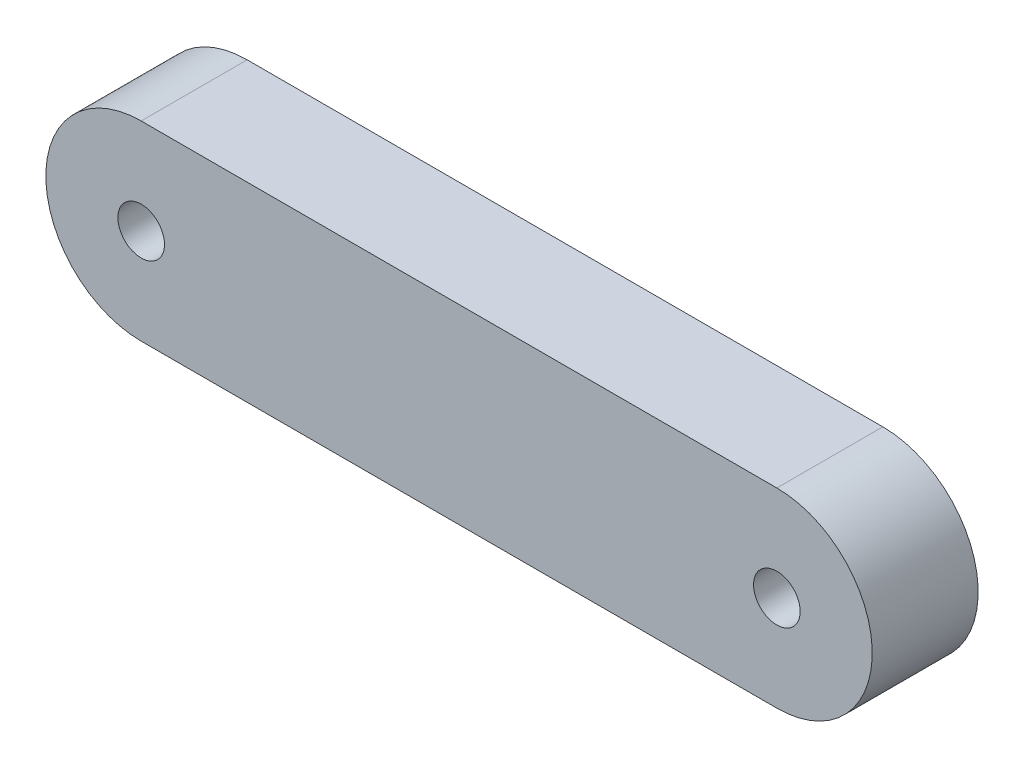
from build123d import *

# Parameters (mm, degrees)
BOSS_EXTRUDE1_DEPTH = 5
SKETCH2_R           = 1.1
CUT_EXTRUDE1_DEPTH  = 21.627651345


with BuildPart() as part:
    # Sketch1 → Boss-Extrude1 (new body)
    with BuildSketch(Plane.XY):
        with BuildLine():
            Line((-15, -4.5), (15, -4.5))
            ThreePointArc((15, -4.5), (19.5, 0), (15, 4.5))
            Line((15, 4.5), (-15, 4.5))
            ThreePointArc((-15, 4.5), (-19.5, 0), (-15, -4.5))
        make_face()
    extrude(amount=BOSS_EXTRUDE1_DEPTH)

    # Sketch2 → Cut-Extrude1 (cut, through all)
    with BuildSketch(Plane.XY.offset(5)):
        with Locations((-15, 0)):
            Circle(SKETCH2_R)
        with Locations((15, 0)):
            Circle(SKETCH2_R)
    extrude(amount=-CUT_EXTRUDE1_DEPTH, mode=Mode.SUBTRACT)


solid = part.part
